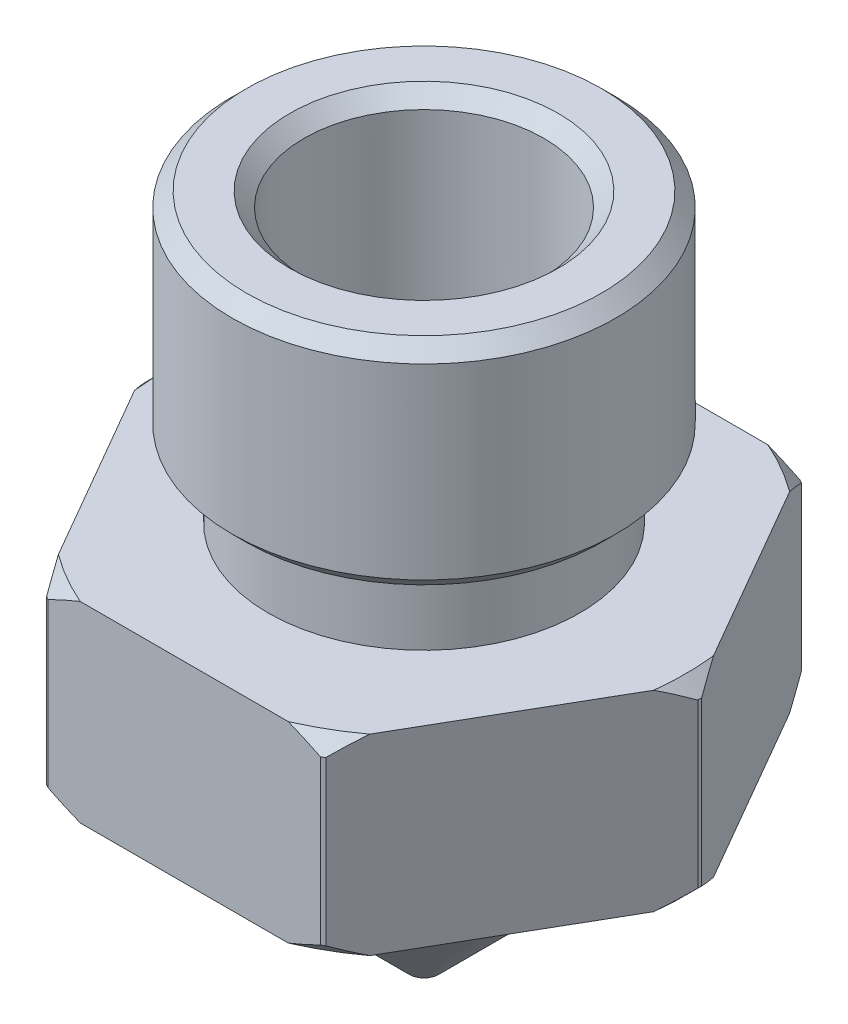
from build123d import *

# Parameters (mm, degrees)
CHAMFER_1_SIZE      = 0.3
SKETCH_2_OUTSIDE_W  = 17.792
SKETCH_2_OUTSIDE_H  = 17.792
CUT_EXTRUDE_1_DEPTH = 12.407234547


with BuildPart() as part:
    # Эскиз1 → Повернуть1 (revolve)
    with BuildSketch(Plane.XY):
        Polygon((2.5, 0), (4, 0), (4, -4.5), (3.25, -4.5), (3.25, -6), (5.75, -6), (5.75, -10), (4.305321998, -10), (0.305321998, -14), (0.2, -13.2), (2.5, -10.458966737), align=None)
    revolve(axis=Axis((0, 8.266911596, 0), (0, -1, 0)))

    # Фаска1
    chamfer_1_edges = [part.edges().sort_by_distance(p)[0] for p in [
        (-5.75, -10, 0),
        (-5.75, -6, 0),
        (-4, -4.5, 0),
        (-2.5, 0, 0),
        (-4, 0, 0),
    ]]
    chamfer(chamfer_1_edges, length=CHAMFER_1_SIZE)

    # Эскиз2 outside → Вырез-Вытянуть1 (cut, through all)
    with BuildSketch(Plane(origin=(0, -6, 0), x_dir=(1, 0, 0), z_dir=(0, 1, 0))):
        Rectangle(SKETCH_2_OUTSIDE_W, SKETCH_2_OUTSIDE_H)
        Polygon((5.773502692, 0), (2.886751346, 5), (-2.886751346, 5), (-5.773502692, 0), (-2.886751346, -5), (2.886751346, -5), align=None, mode=Mode.SUBTRACT)
    extrude(amount=-CUT_EXTRUDE_1_DEPTH, mode=Mode.SUBTRACT)


solid = part.part
